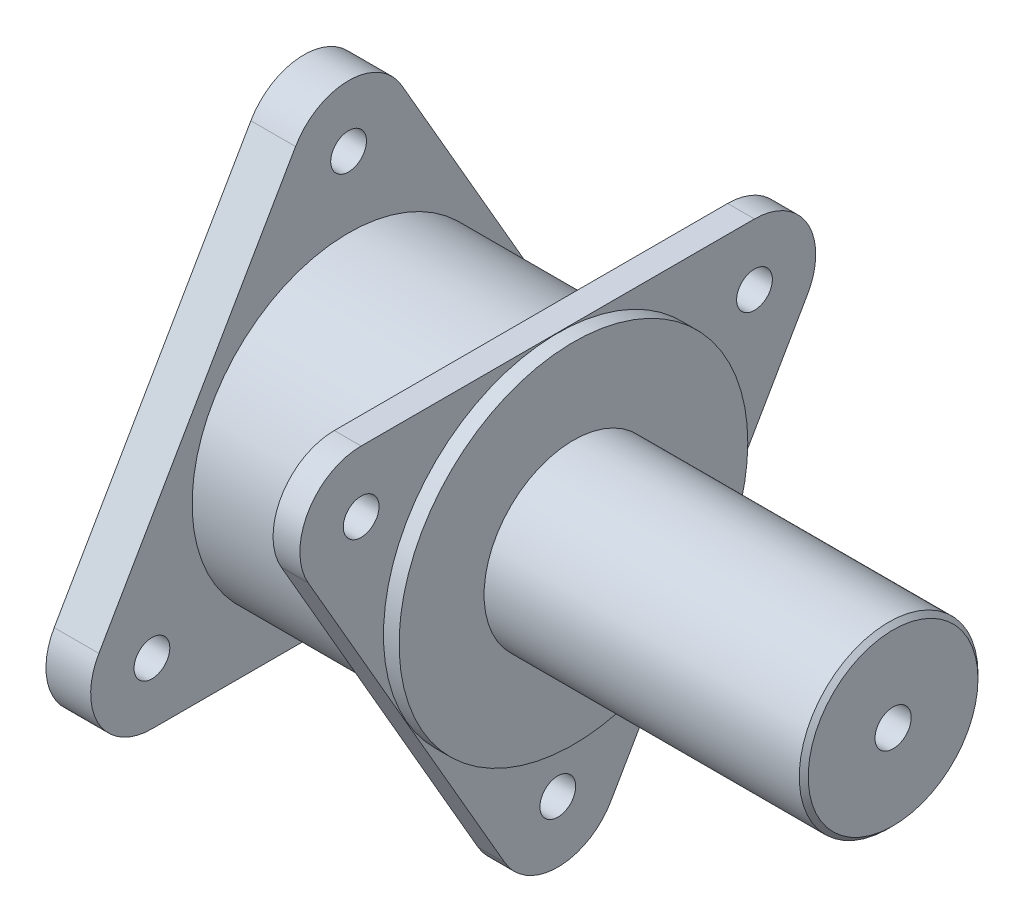
from build123d import *

# Parameters (mm, degrees)
SKETCH10_R           = 4
BOSS_EXTRUDE12_DEPTH = 10
SKETCH11_R           = 35
BOSS_EXTRUDE13_DEPTH = 40.8
SKETCH12_R           = 4
BOSS_EXTRUDE14_DEPTH = 6
SKETCH13_R           = 19.993
BOSS_EXTRUDE15_DEPTH = 75
SKETCH16_R           = 39
BOSS_EXTRUDE16_DEPTH = 3.5
CHAMFER1_SIZE        = 1
SKETCH17_R           = 4.05
CUT_EXTRUDE1_DEPTH   = 131.8


with BuildPart() as part:
    # Sketch10 → Boss-Extrude12 (new body)
    with BuildSketch(Plane(origin=(0, 0, 0), x_dir=(0, 0, -1), z_dir=(1, 0, 0))):
        with BuildLine():
            Line((-55.858638544, -18.55), (-11.864548032, 57.65))
            ThreePointArc((-11.864548032, 57.65), (0, 64.5), (11.864548032, 57.65))
            Line((11.864548032, 57.65), (55.858638544, -18.55))
            ThreePointArc((55.858638544, -18.55), (55.858638544, -32.25), (43.994090512, -39.1))
            Line((43.994090512, -39.1), (-43.994090512, -39.1))
            ThreePointArc((-43.994090512, -39.1), (-55.858638544, -32.25), (-55.858638544, -18.55))
        make_face()
        with Locations((0, 50.8)):
            Circle(SKETCH10_R, mode=Mode.SUBTRACT)
        with Locations((43.994090512, -25.4)):
            Circle(SKETCH10_R, mode=Mode.SUBTRACT)
        with Locations((-43.994090512, -25.4)):
            Circle(SKETCH10_R, mode=Mode.SUBTRACT)
    extrude(amount=BOSS_EXTRUDE12_DEPTH)

    # Sketch11 → Boss-Extrude13 (add)
    with BuildSketch(Plane(origin=(10, 0, 0), x_dir=(0, 0, -1), z_dir=(1, 0, 0))):
        Circle(SKETCH11_R)
    extrude(amount=BOSS_EXTRUDE13_DEPTH)

    # Sketch12 → Boss-Extrude14 (add)
    with BuildSketch(Plane(origin=(50.8, 0, 0), x_dir=(0, 0, -1), z_dir=(1, 0, 0))):
        with BuildLine():
            Line((-43.994090512, 39.1), (43.994090512, 39.1))
            ThreePointArc((43.994090512, 39.1), (55.858638544, 32.25), (55.858638544, 18.55))
            Line((55.858638544, 18.55), (11.864548032, -57.65))
            ThreePointArc((11.864548032, -57.65), (0, -64.5), (-11.864548032, -57.65))
            Line((-11.864548032, -57.65), (-55.858638544, 18.55))
            ThreePointArc((-55.858638544, 18.55), (-55.858638544, 32.25), (-43.994090512, 39.1))
        make_face()
        with Locations((43.994090512, 25.4)):
            Circle(SKETCH12_R, mode=Mode.SUBTRACT)
        with Locations((0, -50.8)):
            Circle(SKETCH12_R, mode=Mode.SUBTRACT)
        with Locations((-43.994090512, 25.4)):
            Circle(SKETCH12_R, mode=Mode.SUBTRACT)
    extrude(amount=BOSS_EXTRUDE14_DEPTH)

    # Sketch13 → Boss-Extrude15 (add)
    with BuildSketch(Plane(origin=(56.8, 0, 0), x_dir=(0, 0, -1), z_dir=(1, 0, 0))):
        Circle(SKETCH13_R)
    extrude(amount=BOSS_EXTRUDE15_DEPTH)

    # Sketch16 → Boss-Extrude16 (add)
    with BuildSketch(Plane(origin=(56.8, 0, 0), x_dir=(0, 0, -1), z_dir=(1, 0, 0))):
        Circle(SKETCH16_R)
    extrude(amount=BOSS_EXTRUDE16_DEPTH)

    # Chamfer1
    chamfer1_edges = [part.edges().sort_by_distance(p)[0] for p in [
        (131.8, 0, 19.993),
    ]]
    chamfer(chamfer1_edges, length=CHAMFER1_SIZE)

    # Sketch17 → Cut-Extrude1 (cut)
    with BuildSketch(Plane(origin=(131.8, 0, 0), x_dir=(0, 0, -1), z_dir=(1, 0, 0))):
        Circle(SKETCH17_R)
    extrude(amount=-CUT_EXTRUDE1_DEPTH, mode=Mode.SUBTRACT)


solid = part.part
